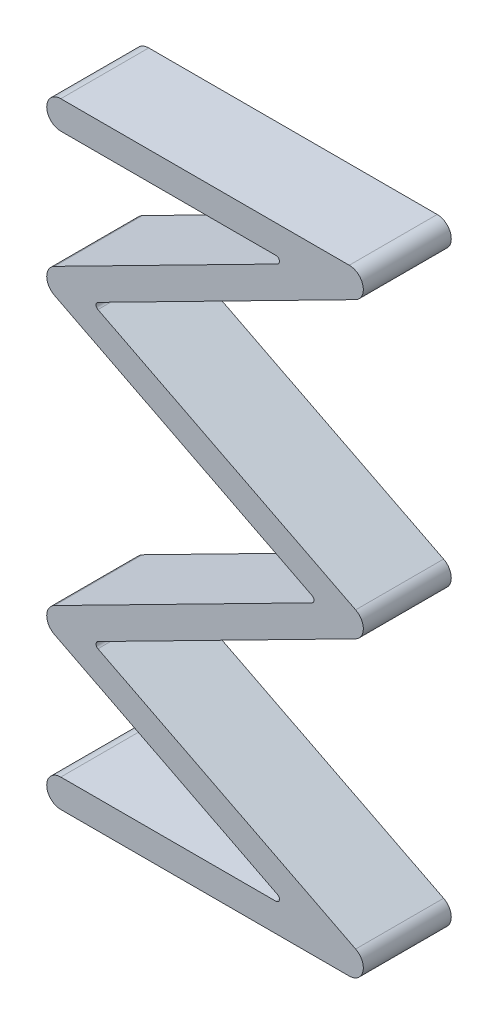
from build123d import *

# Parameters (mm, degrees)
BOSS_EXTRUDE1_DEPTH = 2.5
FILLET1_R           = 0.4
FILLET2_R           = 0.1


with BuildPart() as part:
    # Sketch2 → Boss-Extrude1 (new body)
    with BuildSketch(Plane.XY):
        with BuildLine():
            Line((0.4, 16.7), (6.932774682, 16.7))
            Line((6.932774682, 16.7), (-0.481596575, 12.925))
            Line((-0.481596575, 12.925), (7.718403425, 8.75))
            Line((7.718403425, 8.75), (-0.481596575, 4.575))
            Line((-0.481596575, 4.575), (6.932774682, 0.8))
            Line((6.932774682, 0.8), (0.4, 0.8))
            ThreePointArc((0.4, 0.8), (0, 0.4), (0.4, 0))
            Line((0.4, 0), (10.267225318, 0))
            Line((10.267225318, 0), (1.281596575, 4.575))
            Line((1.281596575, 4.575), (9.481596575, 8.75))
            Line((9.481596575, 8.75), (1.281596575, 12.925))
            Line((1.281596575, 12.925), (10.267225318, 17.5))
            Line((10.267225318, 17.5), (0.4, 17.5))
            ThreePointArc((0.4, 17.5), (0, 17.1), (0.4, 16.7))
        make_face()
    extrude(amount=BOSS_EXTRUDE1_DEPTH)

    # Fillet1
    fillet1_edges = [part.edges().sort_by_distance(p)[0] for p in [
        (10.267225318, 17.5, 1.25),
        (9.481596575, 8.75, 1.25),
        (10.267225318, 0, 1.25),
        (-0.481596575, 4.575, 1.25),
        (-0.481596575, 12.925, 1.25),
    ]]
    fillet(fillet1_edges, radius=FILLET1_R)

    # Fillet2
    fillet2_edges = [part.edges().sort_by_distance(p)[0] for p in [
        (1.281596575, 12.925, 1.25),
        (1.281596575, 4.575, 1.25),
        (6.932774682, 0.8, 1.25),
        (7.718403425, 8.75, 1.25),
        (6.932774682, 16.7, 1.25),
    ]]
    fillet(fillet2_edges, radius=FILLET2_R)


solid = part.part
